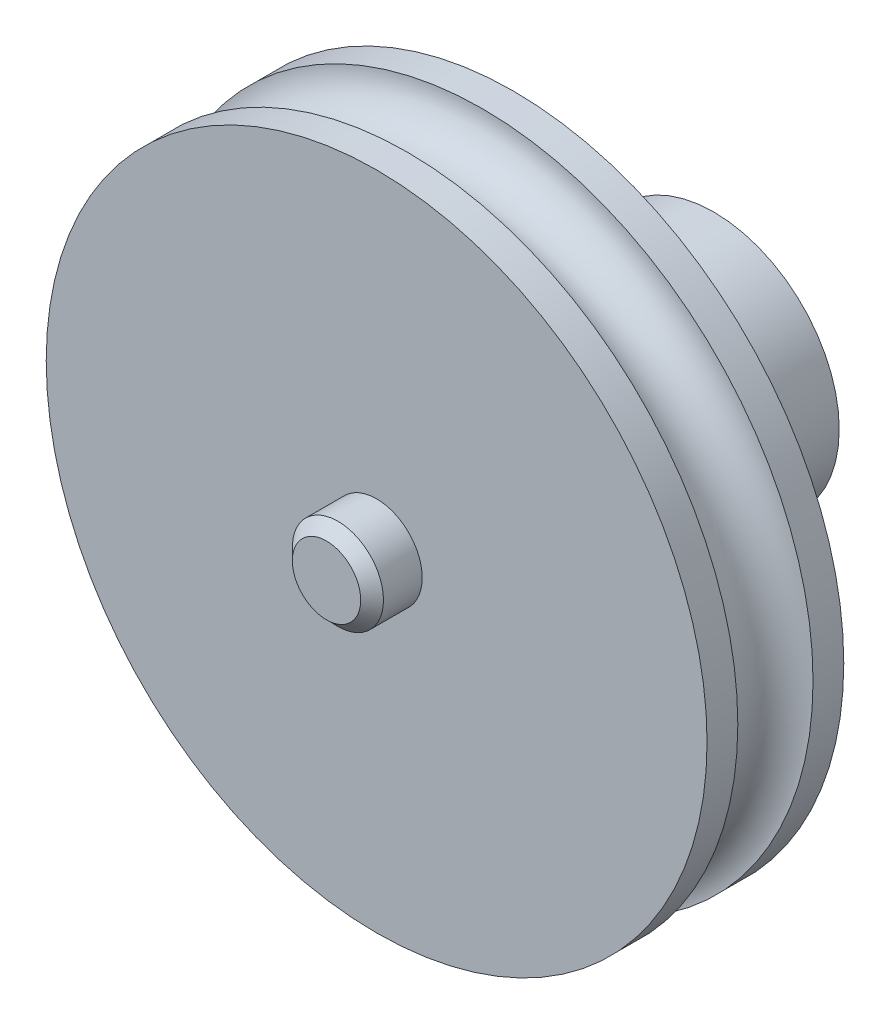
from build123d import *

# Parameters (mm, degrees)
BOSS_EXTRU_1_DEPTH      = 3
BOSS_EXTRU_1_DEPTH_BACK = 3
ESQUISSE1_R             = 14.5
ESQUISSE3_R             = 1.65
ESQUISSE4_R             = 2
BOSS_EXTRU_2_DEPTH      = 2.2
CHANFREIN1_SIZE         = 0.5
ESQUISSE5_R             = 5.5
BOSS_EXTRU_3_DEPTH      = 8.8


with BuildPart() as part:
    # Esquisse1 → Boss.-Extru.1 (new, two sides: drawn at the far end of the back side and taken through both)
    with BuildSketch(Plane.XY.offset(-BOSS_EXTRU_1_DEPTH_BACK)):
        Circle(ESQUISSE1_R)
    extrude(amount=BOSS_EXTRU_1_DEPTH + BOSS_EXTRU_1_DEPTH_BACK)

    # Enlèvement de matière-Balayage1: sweep along a curve in space
    with BuildLine() as enl_vement_de_mati_re_balayage1_path:
        ThreePointArc((14.5, 0, 3), (10.253048327, 10.253048327, 3), (0, 14.5, 3))
        ThreePointArc((0, 14.5, 3), (-10.253048327, 10.253048327, 3), (-14.5, 0, 3))
        ThreePointArc((-14.5, 0, 3), (-10.253048327, -10.253048327, 3), (0, -14.5, 3))
        ThreePointArc((0, -14.5, 3), (10.253048327, -10.253048327, 3), (14.5, 0, 3))
    # Esquisse3 → Enlèvement de matière-Balayage1 (sweep, cut)
    with BuildSketch(Plane(origin=(0, 0, 0), x_dir=(0, 0, -1), z_dir=(1, 0, 0))):
        with Locations((0, 14.5)):
            Circle(ESQUISSE3_R)
    sweep(path=enl_vement_de_mati_re_balayage1_path.line, mode=Mode.SUBTRACT)

    # Esquisse4 → Boss.-Extru.2 (add)
    with BuildSketch(Plane.XY.offset(3)):
        Circle(ESQUISSE4_R)
    extrude(amount=BOSS_EXTRU_2_DEPTH)

    # Chanfrein1
    chanfrein1_edges = [part.edges().sort_by_distance(p)[0] for p in [
        (-2, 0, 5.2),
    ]]
    chamfer(chanfrein1_edges, length=CHANFREIN1_SIZE)

    # Esquisse5 → Boss.-Extru.3 (add)
    with BuildSketch(Plane(origin=(0, 0, -3), x_dir=(-1, 0, 0), z_dir=(0, 0, -1))):
        Circle(ESQUISSE5_R)
    extrude(amount=BOSS_EXTRU_3_DEPTH)


solid = part.part
